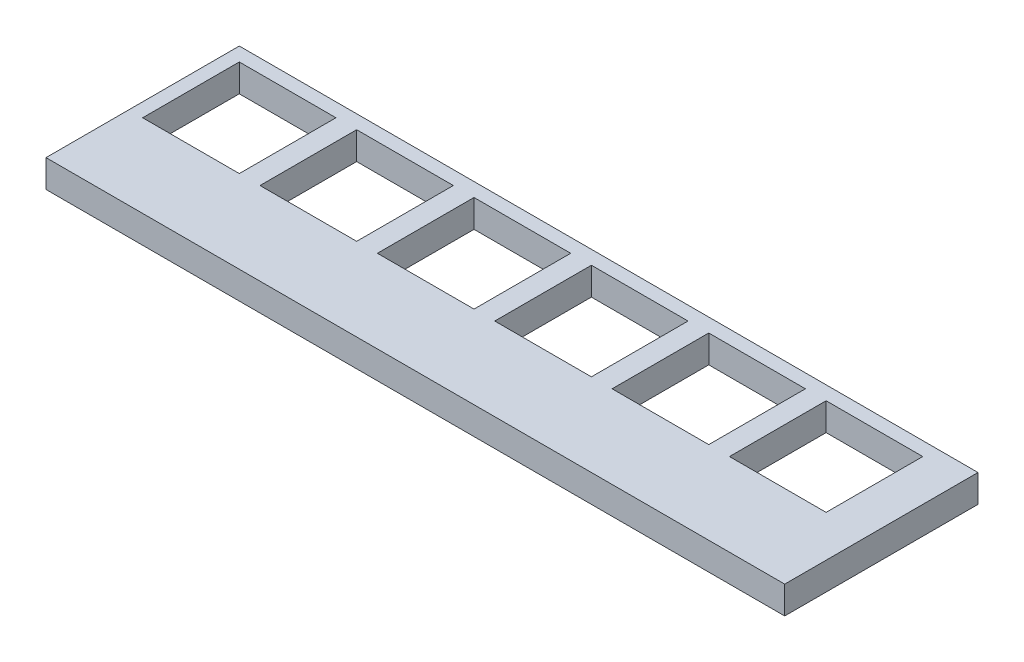
from build123d import *

# Parameters (mm, degrees)
EXTRUDE_1_DEPTH = 4


with BuildPart() as part:
    # Sketch 1 → Бобышка-Вытянуть1 (new body)
    with BuildSketch(Plane(origin=(26.561401347, 0, 21.984207178), x_dir=(-0.9674249636260779, -8.775997465141552e-15, 0.25315793440672957), z_dir=(0, 1, 0))):
        Polygon((0, 0), (7.088422163, 27.087898982), (110.602893271, 0), (103.514471108, -27.087898982), align=None)
        Polygon((9.855076732, 13.959851812), (6.310865651, 0.415902321), (19.854815141, -3.128308761), (23.399026223, 10.41564073), align=None, mode=Mode.SUBTRACT)
        Polygon((105.630148131, -11.102783695), (102.08593705, -24.646733185), (88.541987559, -21.102522104), (92.08619864, -7.558572613), align=None, mode=Mode.SUBTRACT)
        Polygon((89.18392375, -6.79909881), (85.639712668, -20.343048301), (72.095763177, -16.798837219), (75.639974259, -3.254887728), align=None, mode=Mode.SUBTRACT)
        Polygon((69.193488286, -16.039363416), (55.649538795, -12.495152334), (59.193749877, 1.048797157), (72.737699368, -2.495413925), align=None, mode=Mode.SUBTRACT)
        Polygon((52.747263905, -11.735678531), (56.291474986, 1.80827096), (42.747525496, 5.352482042), (39.203314414, -8.191467449), align=None, mode=Mode.SUBTRACT)
        Polygon((39.845250605, 6.111955845), (26.301301114, 9.656166927), (22.757090032, -3.887782564), (36.301039523, -7.431993646), align=None, mode=Mode.SUBTRACT)
    extrude(amount=EXTRUDE_1_DEPTH)


solid = part.part
